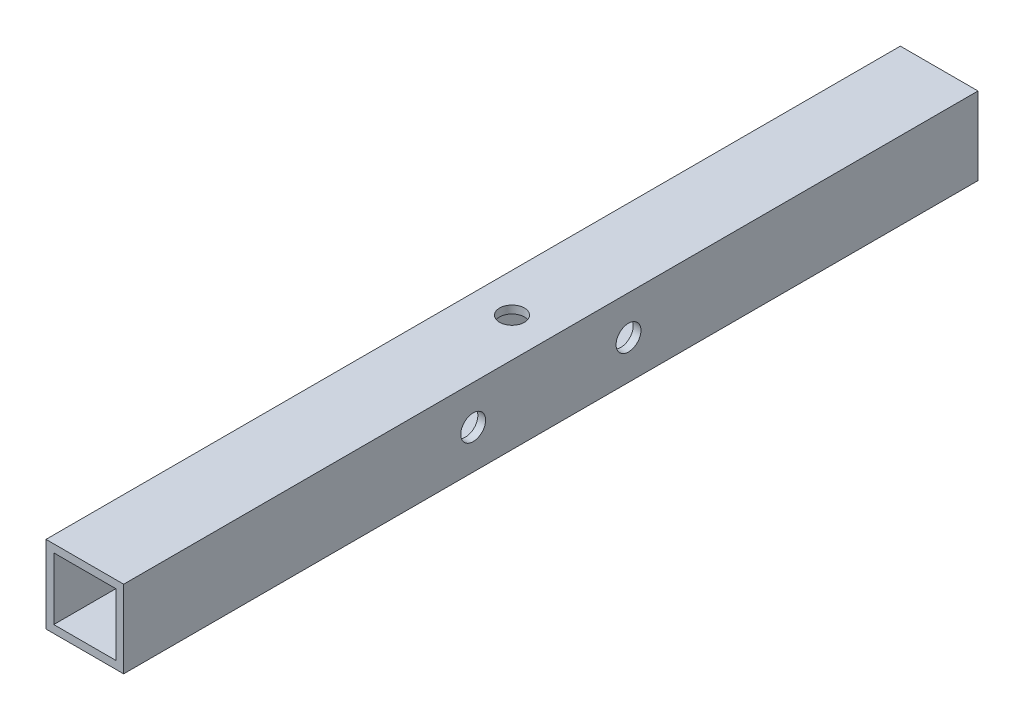
from build123d import *

# Parameters (mm, degrees)
SKETCH_1_W          = 10
SKETCH_1_H          = 10
SKETCH_1_W_2        = 8
SKETCH_1_H_2        = 8
EXTRUDE_1_DEPTH     = 110
SKETCH_2_R          = 1.6
CUT_EXTRUDE_1_DEPTH = 111.566721937
SKETCH_3_R          = 1.6
CUT_EXTRUDE_2_DEPTH = 111.566721937


with BuildPart() as part:
    # ｽｹｯﾁ1 → ﾎﾞｽ - 押し出し1 (new body)
    with BuildSketch(Plane.XY):
        Rectangle(SKETCH_1_W, SKETCH_1_H)
        Rectangle(SKETCH_1_W_2, SKETCH_1_H_2, mode=Mode.SUBTRACT)
    extrude(amount=EXTRUDE_1_DEPTH)

    # ｽｹｯﾁ2 → ｶｯﾄ - 押し出し1 (cut, through all)
    with BuildSketch(Plane(origin=(0, 5, 0), x_dir=(1, 0, 0), z_dir=(0, 1, 0))):
        with Locations(Location((0, -55, 0), (0, 0, 270))):
            Circle(SKETCH_2_R)
    extrude(amount=-CUT_EXTRUDE_1_DEPTH, mode=Mode.SUBTRACT)

    # ｽｹｯﾁ3 → ｶｯﾄ - 押し出し2 (cut, through all)
    with BuildSketch(Plane(origin=(5, 0, 0), x_dir=(0, 0, -1), z_dir=(1, 0, 0))):
        with Locations((-65, 0)):
            Circle(SKETCH_3_R)
        with Locations((-45, 0)):
            Circle(SKETCH_3_R)
    extrude(amount=-CUT_EXTRUDE_2_DEPTH, mode=Mode.SUBTRACT)


solid = part.part
